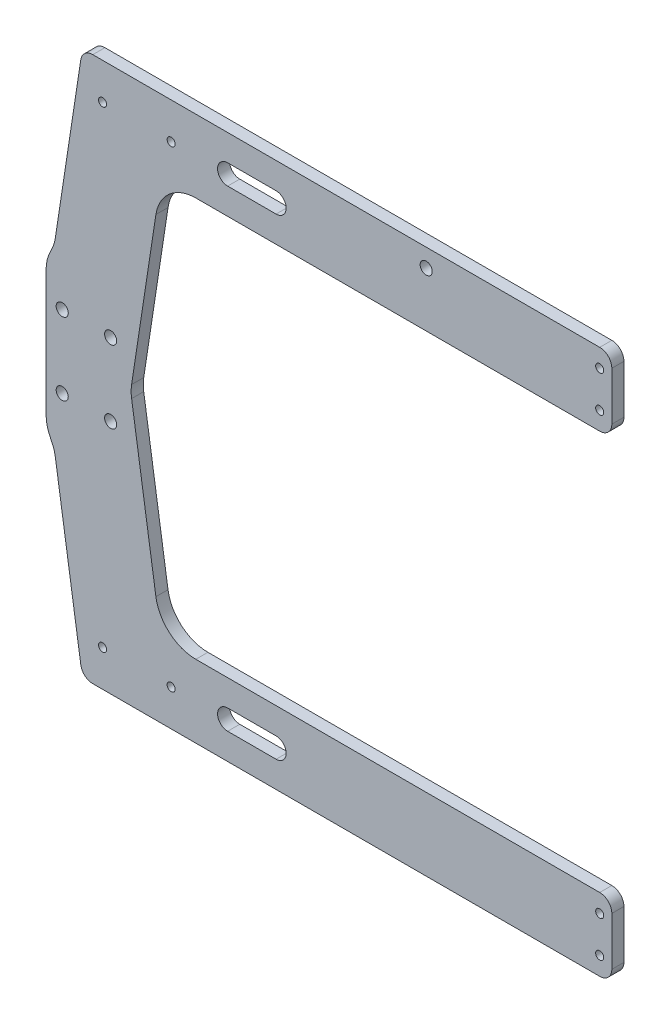
from build123d import *

# Parameters (mm, degrees)
SKETCH_1_R          = 1
EXTRUDE_1_DEPTH     = 3
FILLET_1_R          = 10
FILLET_2_R          = 10
FILLET_3_R          = 5
FILLET_4_R          = 3
FILLET_5_R          = 10
SKETCH_5_R          = 1.5
CUT_EXTRUDE_2_DEPTH = 10
SKETCH_6_W          = 40
SKETCH_6_H          = 36.981974808
CUT_EXTRUDE_3_DEPTH = 10
FILLET_6_R          = 10
SKETCH_7_R          = 1.5
CUT_EXTRUDE_4_DEPTH = 31


with BuildPart() as part:
    # 草图1 → 凸台-拉伸1 (new body)
    with BuildSketch(Plane.XY):
        Polygon((0, 15), (0, -15), (41, -15), (49, -67.5), (180.2, -67.5), (180.2, -49.5), (68.511096619, -49.5), (60.968239476, 0), (68.511096619, 49.5), (180.2, 49.5), (180.2, 67.5), (49, 67.5), (41, 15), align=None)
        with Locations((54, -58.5)):
            Circle(SKETCH_1_R, mode=Mode.SUBTRACT)
        with Locations((71, -58.5)):
            Circle(SKETCH_1_R, mode=Mode.SUBTRACT)
        with BuildLine():
            ThreePointArc((85, -61), (82.5, -58.5), (85, -56))
            Line((85, -56), (97, -56))
            ThreePointArc((97, -56), (99.5, -58.5), (97, -61))
            Line((97, -61), (85, -61))
        make_face(mode=Mode.SUBTRACT)
        with Locations((177.2, -63)):
            Circle(SKETCH_1_R, mode=Mode.SUBTRACT)
        with Locations((177.2, -54)):
            Circle(SKETCH_1_R, mode=Mode.SUBTRACT)
        with Locations((54, 58.5)):
            Circle(SKETCH_1_R, mode=Mode.SUBTRACT)
        with Locations((71, 58.5)):
            Circle(SKETCH_1_R, mode=Mode.SUBTRACT)
        with BuildLine():
            Line((97, 56), (85, 56))
            ThreePointArc((85, 56), (82.5, 58.5), (85, 61))
            Line((85, 61), (97, 61))
            ThreePointArc((97, 61), (99.5, 58.5), (97, 56))
        make_face(mode=Mode.SUBTRACT)
        with Locations((177.2, 54)):
            Circle(SKETCH_1_R, mode=Mode.SUBTRACT)
        with Locations((177.2, 63)):
            Circle(SKETCH_1_R, mode=Mode.SUBTRACT)
    extrude(amount=EXTRUDE_1_DEPTH)

    # 圆角1
    fillet_1_edges = [part.edges().sort_by_distance(p)[0] for p in [
        (41, -15, 1.5),
        (41, 15, 1.5),
    ]]
    fillet(fillet_1_edges, radius=FILLET_1_R)

    # 圆角2
    fillet_2_edges = [part.edges().sort_by_distance(p)[0] for p in [
        (68.511096619, -49.5, 1.5),
        (68.511096619, 49.5, 1.5),
    ]]
    fillet(fillet_2_edges, radius=FILLET_2_R)

    # 圆角3
    fillet_3_edges = [part.edges().sort_by_distance(p)[0] for p in [
        (0, -15, 1.5),
        (0, 15, 1.5),
    ]]
    fillet(fillet_3_edges, radius=FILLET_3_R)

    # 圆角4
    fillet_4_edges = [part.edges().sort_by_distance(p)[0] for p in [
        (180.2, -67.5, 1.5),
        (180.2, -49.5, 1.5),
        (180.2, 49.5, 1.5),
        (180.2, 67.5, 1.5),
        (49, -67.5, 1.5),
        (49, 67.5, 1.5),
    ]]
    fillet(fillet_4_edges, radius=FILLET_4_R)

    # 圆角5
    fillet_5_edges = [part.edges().sort_by_distance(p)[0] for p in [
        (60.968239476, 0, 1.5),
    ]]
    fillet(fillet_5_edges, radius=FILLET_5_R)

    # 草图5 → 切除-拉伸2 (cut)
    with BuildSketch(Plane.XY.offset(3)):
        with Locations((134.2, 63)):
            Circle(SKETCH_5_R)
    extrude(amount=-CUT_EXTRUDE_2_DEPTH, mode=Mode.SUBTRACT)

    # 草图6 → 切除-拉伸3 (cut)
    with BuildSketch(Plane.XY.offset(3)):
        with Locations((20, 0)):
            Rectangle(SKETCH_6_W, SKETCH_6_H)
    extrude(amount=-CUT_EXTRUDE_3_DEPTH, mode=Mode.SUBTRACT)

    # 圆角6
    fillet_6_edges = [part.edges().sort_by_distance(p)[0] for p in [
        (40, -18.490987404, 1.5),
        (40, 18.490987404, 1.5),
    ]]
    fillet(fillet_6_edges, radius=FILLET_6_R)

    # 草图7 → 切除-拉伸4 (cut)
    with BuildSketch(Plane.XY.offset(3)):
        with Locations((44, 9)):
            Circle(SKETCH_7_R)
        with Locations((56, 9)):
            Circle(SKETCH_7_R)
        with Locations((44, -9)):
            Circle(SKETCH_7_R)
        with Locations((56, -9)):
            Circle(SKETCH_7_R)
    extrude(amount=-CUT_EXTRUDE_4_DEPTH, mode=Mode.SUBTRACT)


solid = part.part
